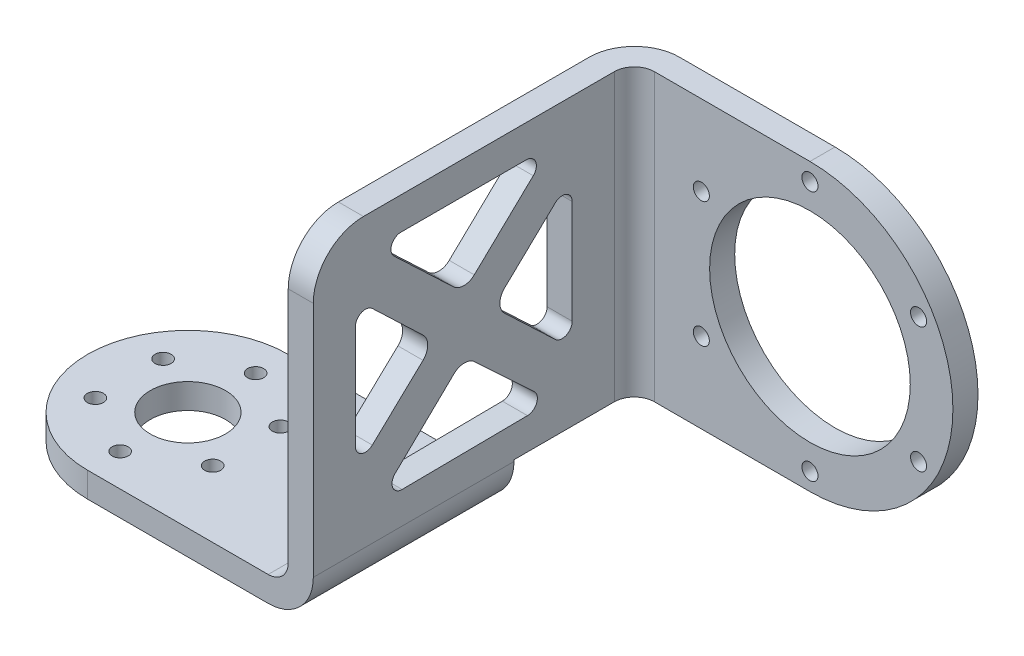
from build123d import *

# Parameters (mm, degrees)
SKETCH_1_R          = 20
EXTRUDE_1_DEPTH     = 5
SKETCH_3_R          = 1.6
CUT_EXTRUDE_1_DEPTH = 11
EXTRUDE_3_DEPTH     = 5
EXTRUDE_4_DEPTH     = 5
SKETCH_25_R         = 20
CUT_EXTRUDE_2_DEPTH = 5
FILLET_1_R          = 4
FILLET_4_R          = 9
SKETCH_19_R         = 7.5
CUT_EXTRUDE_3_DEPTH = 5
SKETCH_26_R         = 1.6
CUT_EXTRUDE_4_DEPTH = 5
FILLET_5_R          = 10
CUT_EXTRUDE_5_DEPTH = 5
FILLET_10_R         = 2
FILLET_11_R         = 3


with BuildPart() as part:
    # 草图1 → 凸台-拉伸1 (new body)
    with BuildSketch(Plane(origin=(0, 0, 0), x_dir=(1, 0, 0), z_dir=(0, 1, 0))):
        Circle(SKETCH_1_R)
        with BuildLine():
            Line((45, 20), (0, 20))
            ThreePointArc((0, 20), (14.142135624, 14.142135624), (20, 0))
            ThreePointArc((20, 0), (14.142135624, -14.142135624), (0, -20))
            Line((0, -20), (45, -20))
            Line((45, -20), (45, 20))
        make_face()
    extrude(amount=EXTRUDE_1_DEPTH)

    # 草图3 → 切除-拉伸1 (cut)
    with BuildSketch(Plane(origin=(0, 5, 0), x_dir=(1, 0, 0), z_dir=(0, 1, 0))):
        with Locations(Location((0, 13.5, 0), (0, 0, 270))):
            Circle(SKETCH_3_R)
        with Locations(Location((11.691342951, 6.75, 0), (0, 0, 270))):
            Circle(SKETCH_3_R)
        with Locations(Location((11.691342951, -6.75, 0), (0, 0, 270))):
            Circle(SKETCH_3_R)
        with Locations(Location((0, -13.5, 0), (0, 0, 270))):
            Circle(SKETCH_3_R)
        with Locations(Location((-11.691342951, -6.75, 0), (0, 0, 270))):
            Circle(SKETCH_3_R)
        with Locations(Location((-11.691342951, 6.75, 0), (0, 0, 270))):
            Circle(SKETCH_3_R)
    extrude(amount=-CUT_EXTRUDE_1_DEPTH, mode=Mode.SUBTRACT)

    # 草图22 → 凸台-拉伸3 (add)
    with BuildSketch(Plane(origin=(45, 0, 0), x_dir=(0, 0, -1), z_dir=(1, 0, 0))):
        Polygon((-20, 5), (20, 5), (20, 9.3), (44, 9.3), (44, 66.3), (-20, 66.3), align=None)
    extrude(amount=-EXTRUDE_3_DEPTH)

    # 草图24 → 凸台-拉伸4 (add)
    with BuildSketch(Plane(origin=(0, 0, -44), x_dir=(-1, 0, 0), z_dir=(0, 0, -1))):
        with BuildLine():
            Line((-40, 9.3), (-80, 9.3))
            ThreePointArc((-80, 9.3), (-108.5, 37.8), (-80, 66.3))
            Line((-80, 66.3), (-40, 66.3))
            Line((-40, 66.3), (-40, 9.3))
        make_face()
    extrude(amount=EXTRUDE_4_DEPTH)

    # 草图25 → 切除-拉伸2 (cut)
    with BuildSketch(Plane(origin=(0, 0, -49), x_dir=(-1, 0, 0), z_dir=(0, 0, -1))):
        with Locations((-80, 37.8)):
            Circle(SKETCH_25_R)
    extrude(amount=-CUT_EXTRUDE_2_DEPTH, mode=Mode.SUBTRACT)

    # 圆角1
    fillet_1_edges = [part.edges().sort_by_distance(p)[0] for p in [
        (40, 5, 0),
        (45, 37.8, -44),
    ]]
    fillet(fillet_1_edges, radius=FILLET_1_R)

    # 圆角4
    fillet_4_edges = [part.edges().sort_by_distance(p)[0] for p in [
        (45, 0, 0),
        (40, 37.8, -49),
    ]]
    fillet(fillet_4_edges, radius=FILLET_4_R)

    # 草图19 → 切除-拉伸3 (cut)
    with BuildSketch(Plane.XZ):
        with Locations(Location((0, 0, 0), (0, 0, 270))):
            Circle(SKETCH_19_R)
    extrude(amount=-CUT_EXTRUDE_3_DEPTH, mode=Mode.SUBTRACT)

    # 草图26 → 切除-拉伸4 (cut)
    with BuildSketch(Plane.XY.offset(-44)):
        with Locations((101.650635095, 50.3)):
            Circle(SKETCH_26_R)
        with Locations((101.650635095, 25.3)):
            Circle(SKETCH_26_R)
        with Locations((80, 12.8)):
            Circle(SKETCH_26_R)
        with Locations((58.349364905, 25.3)):
            Circle(SKETCH_26_R)
        with Locations((58.349364905, 50.3)):
            Circle(SKETCH_26_R)
        with Locations((80, 62.8)):
            Circle(SKETCH_26_R)
    extrude(amount=-CUT_EXTRUDE_4_DEPTH, mode=Mode.SUBTRACT)

    # 圆角5
    fillet_5_edges = [part.edges().sort_by_distance(p)[0] for p in [
        (42.5, 66.3, 20),
    ]]
    fillet(fillet_5_edges, radius=FILLET_5_R)

    # 草图27 → 切除-拉伸5 (cut)
    with BuildSketch(Plane(origin=(45, 0, 0), x_dir=(0, 0, -1), z_dir=(1, 0, 0))):
        Polygon((10.027417726, 43.207223614), (-7.542180321, 59.853257478), (27.457819679, 59.853257478), align=None)
        Polygon((15.84211595, 37.698181047), (31.611388693, 52.757836516), (31.611388693, 22.757836516), align=None)
        Polygon((-7.31927621, 15.272435239), (27.678973834, 15.622426489), (10.082987202, 32.093328411), align=None)
        Polygon((-11.611388693, 52.757836516), (-11.611388693, 22.757836516), (4.15788405, 37.698181047), align=None)
    extrude(amount=-CUT_EXTRUDE_5_DEPTH, mode=Mode.SUBTRACT)

    # 圆角10
    fillet_10_edges = [part.edges().sort_by_distance(p)[0] for p in [
        (42.5, 15.272435239, 7.31927621),
        (42.5, 15.622426489, -27.678973834),
        (42.5, 22.757836516, -31.611388693),
        (42.5, 52.757836516, -31.611388693),
        (42.5, 52.757836516, 11.611388693),
        (42.5, 22.757836516, 11.611388693),
        (42.5, 59.853257478, -27.457819679),
        (42.5, 59.853257478, 7.542180321),
    ]]
    fillet(fillet_10_edges, radius=FILLET_10_R)

    # 圆角11
    fillet_11_edges = [part.edges().sort_by_distance(p)[0] for p in [
        (42.5, 32.093328411, -10.082987202),
        (42.5, 37.698181047, -15.84211595),
        (42.5, 37.698181047, -4.15788405),
        (42.5, 43.207223614, -10.027417726),
    ]]
    fillet(fillet_11_edges, radius=FILLET_11_R)


solid = part.part
